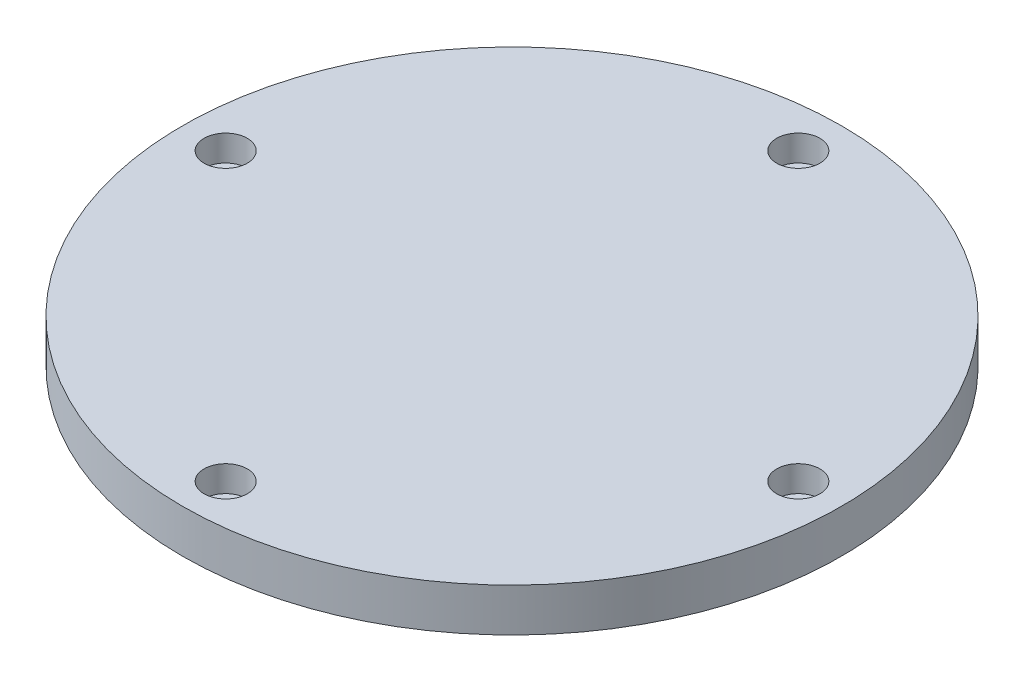
from build123d import *

# Parameters (mm, degrees)
SKETCH1_R           = 38.1
BOSS_EXTRUDE1_DEPTH = 5
SKETCH2_R           = 2.5
CUT_EXTRUDE1_DEPTH  = 3


with BuildPart() as part:
    # Sketch1 → Boss-Extrude1 (new body)
    with BuildSketch(Plane(origin=(0, 0, 0), x_dir=(1, 0, 0), z_dir=(0, 1, 0))):
        with Locations(Location((0, 0, 0), (0, 0, 270))):
            Circle(SKETCH1_R)
    extrude(amount=BOSS_EXTRUDE1_DEPTH)

    # Sketch2 → Cut-Extrude1 (cut)
    with BuildSketch(Plane(origin=(0, 5, 0), x_dir=(1, 0, 0), z_dir=(0, 1, 0))):
        with Locations(Location((-33.1, 0, 0), (0, 0, 270))):
            Circle(SKETCH2_R)
        with Locations(Location((0, -33.1, 0), (0, 0, 270))):
            Circle(SKETCH2_R)
        with Locations(Location((33.1, 0, 0), (0, 0, 270))):
            Circle(SKETCH2_R)
        with Locations(Location((0, 33.1, 0), (0, 0, 270))):
            Circle(SKETCH2_R)
    extrude(amount=-CUT_EXTRUDE1_DEPTH, mode=Mode.SUBTRACT)


solid = part.part
